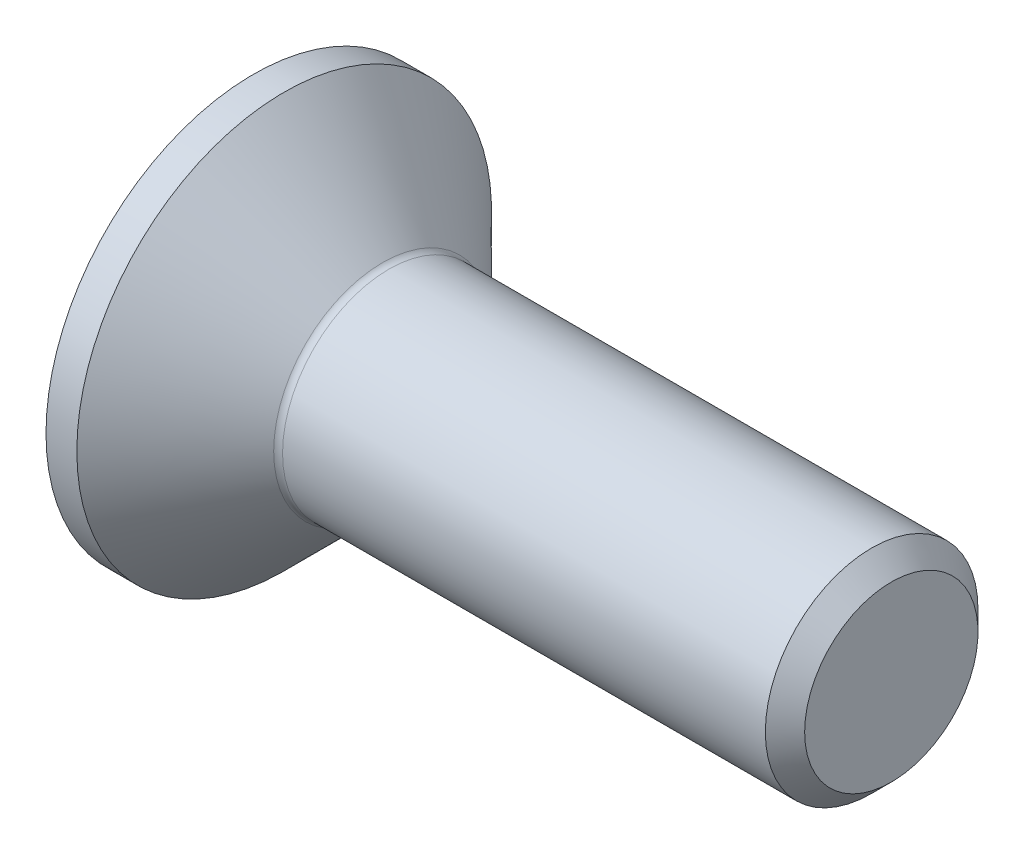
from build123d import *

# Parameters (mm, degrees)
FILLET1_R   = 0.25
HEX_2_DEPTH = 2.2


with BuildPart() as part:
    # BodySke → BaseBody (revolve)
    with BuildSketch(Plane.XY, mode=Mode.PRIVATE) as basebody_sk:
        Polygon((0, 0), (0, 5.85), (0.87, 5.85), (3.72, 3), (17.4455, 3), (18, 2.4455), (18, 0), align=None)
    revolve(basebody_sk.sketch.rotate(Axis((0, 0, 0), (1, 0, 0)), 90), axis=Axis((0, 0, 0), (1, 0, 0)))

    # Fillet1
    fillet1_edges = [part.edges().sort_by_distance(p)[0] for p in [
        (3.72, 0, -3),
    ]]
    fillet(fillet1_edges, radius=FILLET1_R)

    # Sketch2 → PreBroach (revolve, cut)
    with BuildSketch(Plane.XY, mode=Mode.PRIVATE) as prebroach_sk:
        Polygon((0, 2), (2.2, 2), (3.354700538, 0), (0, 0), align=None)
    revolve(prebroach_sk.sketch.rotate(Axis((0, 0, 0), (1, 0, 0)), 90), axis=Axis((0, 0, 0), (1, 0, 0)), mode=Mode.SUBTRACT)

    # Sketch3 → Hex 2 (cut)
    with BuildSketch(Plane.ZY):
        Polygon((-2, -1.154700538), (-2, 1.154700538), (0, 2.309401077), (2, 1.154700538), (2, -1.154700538), (0, -2.309401077), align=None)
    extrude(amount=-HEX_2_DEPTH, mode=Mode.SUBTRACT)


solid = part.part
